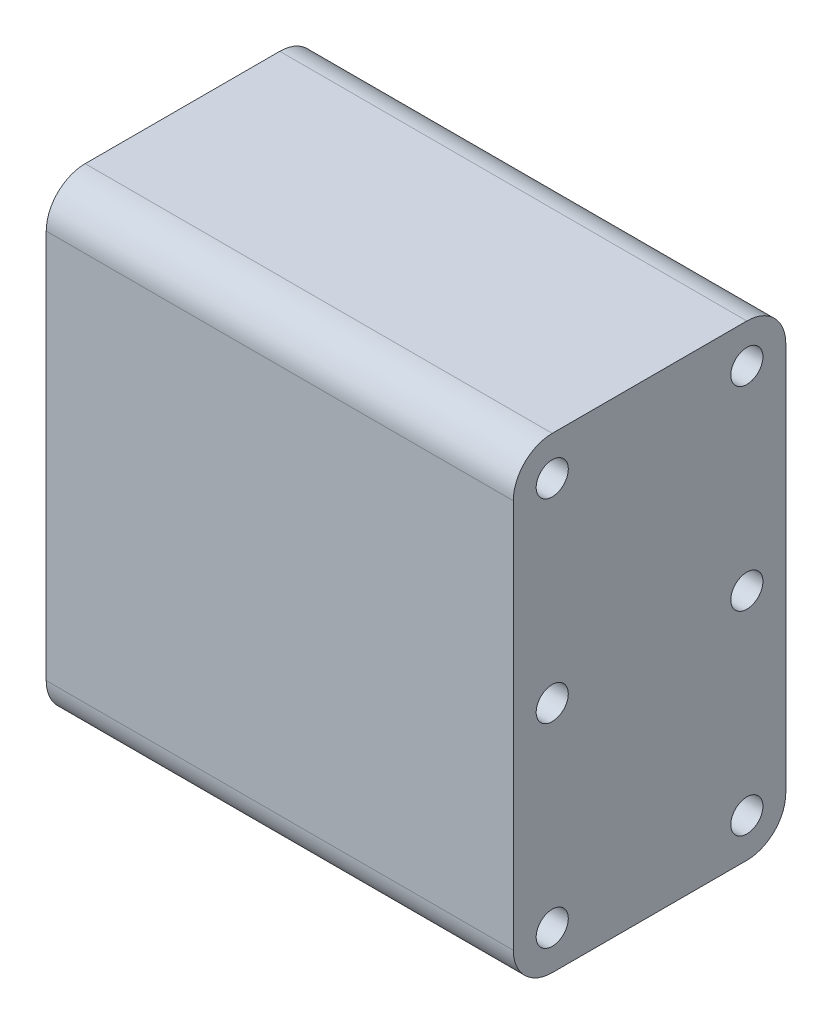
from build123d import *

# Parameters (mm, degrees)
SKETCH_1_R          = 1.7
SKETCH_1_R_2        = 1.65
EXTRUDE_1_DEPTH     = 3
SKETCH_2_W          = 28
SKETCH_2_H          = 48
EXTRUDE_2_DEPTH     = 48
FILLET_1_R          = 4
SKETCH_3_R          = 1.65
CUT_EXTRUDE_1_DEPTH = 4
CUT_EXTRUDE_START   = -4
SKETCH_4_R          = 1.65
CUT_EXTRUDE_2_DEPTH = 4
FILLET_2_R          = 2


with BuildPart() as part:
    # 草图1 → 凸台-拉伸1 (new body)
    with BuildSketch(Plane(origin=(0, 0, 0), x_dir=(0, 0, -1), z_dir=(1, 0, 0))):
        with BuildLine():
            Line((13, -3.07523153), (13, -7.07523153))
            Line((13, -7.07523153), (17, -7.07523153))
            ThreePointArc((17, -7.07523153), (20, -10.07523153), (17, -13.07523153))
            Line((17, -13.07523153), (13, -13.07523153))
            Line((13, -13.07523153), (13, -17.07523153))
            ThreePointArc((13, -17.07523153), (10, -20.07523153), (7, -17.07523153))
            Line((7, -17.07523153), (7, -13.07523153))
            Line((7, -13.07523153), (3, -13.07523153))
            ThreePointArc((3, -13.07523153), (0, -10.07523153), (3, -7.07523153))
            Line((3, -7.07523153), (7, -7.07523153))
            Line((7, -7.07523153), (7, -3.07523153))
            ThreePointArc((7, -3.07523153), (10, -0.07523153), (13, -3.07523153))
        make_face()
        with Locations((10, -3.07523153)):
            Circle(SKETCH_1_R, mode=Mode.SUBTRACT)
        with Locations((3, -10.07523153)):
            Circle(SKETCH_1_R_2, mode=Mode.SUBTRACT)
        with Locations((10, -17.07523153)):
            Circle(SKETCH_1_R, mode=Mode.SUBTRACT)
        with Locations((17, -10.07523153)):
            Circle(SKETCH_1_R, mode=Mode.SUBTRACT)
        with Locations((10, -10.07523153)):
            Circle(SKETCH_1_R, mode=Mode.SUBTRACT)
    extrude(amount=EXTRUDE_1_DEPTH)

    # 草图2 → 凸台-拉伸2 (add)
    with BuildSketch(Plane(origin=(3, 0, 0), x_dir=(0, 0, -1), z_dir=(1, 0, 0))):
        with Locations((10, -20.07523153)):
            Rectangle(SKETCH_2_W, SKETCH_2_H)
    extrude(amount=EXTRUDE_2_DEPTH)

    # 圆角1
    fillet_1_edges = [part.edges().sort_by_distance(p)[0] for p in [
        (27, 3.92476847, -24),
        (27, 3.92476847, 4),
        (27, -44.07523153, 4),
        (27, -44.07523153, -24),
    ]]
    fillet(fillet_1_edges, radius=FILLET_1_R)

    # 草图3 → 切除-拉伸1 (cut)
    with BuildSketch(Plane.ZY.offset(-3)):
        with Locations((-20, -0.07523153)):
            Circle(SKETCH_3_R)
        with Locations((0, -0.07523153)):
            Circle(SKETCH_3_R)
        with Locations((0, -20.07523153)):
            Circle(SKETCH_3_R)
        with Locations((-20, -20.07523153)):
            Circle(SKETCH_3_R)
        with Locations((-20, -40.07523153)):
            Circle(SKETCH_3_R)
        with Locations((0, -40.07523153)):
            Circle(SKETCH_3_R)
    extrude(amount=-CUT_EXTRUDE_1_DEPTH, mode=Mode.SUBTRACT)

    # 草图4 → 切除-拉伸2 (cut)
    with BuildSketch(Plane(origin=(51, 0, 0), x_dir=(0, 0, -1), z_dir=(1, 0, 0)).offset(CUT_EXTRUDE_START)):
        with Locations(Location((0, -0.07523153, 0), (0, 0, 180))):
            Circle(SKETCH_4_R)
        with Locations(Location((20, -0.07523153, 0), (0, 0, 180))):
            Circle(SKETCH_4_R)
        with Locations(Location((0, -20.07523153, 0), (0, 0, 180))):
            Circle(SKETCH_4_R)
        with Locations(Location((20, -20.07523153, 0), (0, 0, 180))):
            Circle(SKETCH_4_R)
        with Locations(Location((0, -40.07523153, 0), (0, 0, 180))):
            Circle(SKETCH_4_R)
        with Locations(Location((20, -40.07523153, 0), (0, 0, 180))):
            Circle(SKETCH_4_R)
    extrude(amount=CUT_EXTRUDE_2_DEPTH, mode=Mode.SUBTRACT)

    # 圆角2
    fillet_2_edges = [part.edges().sort_by_distance(p)[0] for p in [
        (1.5, -13.07523153, -13),
        (1.5, -13.07523153, -7),
        (1.5, -7.07523153, -7),
        (1.5, -7.07523153, -13),
    ]]
    fillet(fillet_2_edges, radius=FILLET_2_R)


solid = part.part
